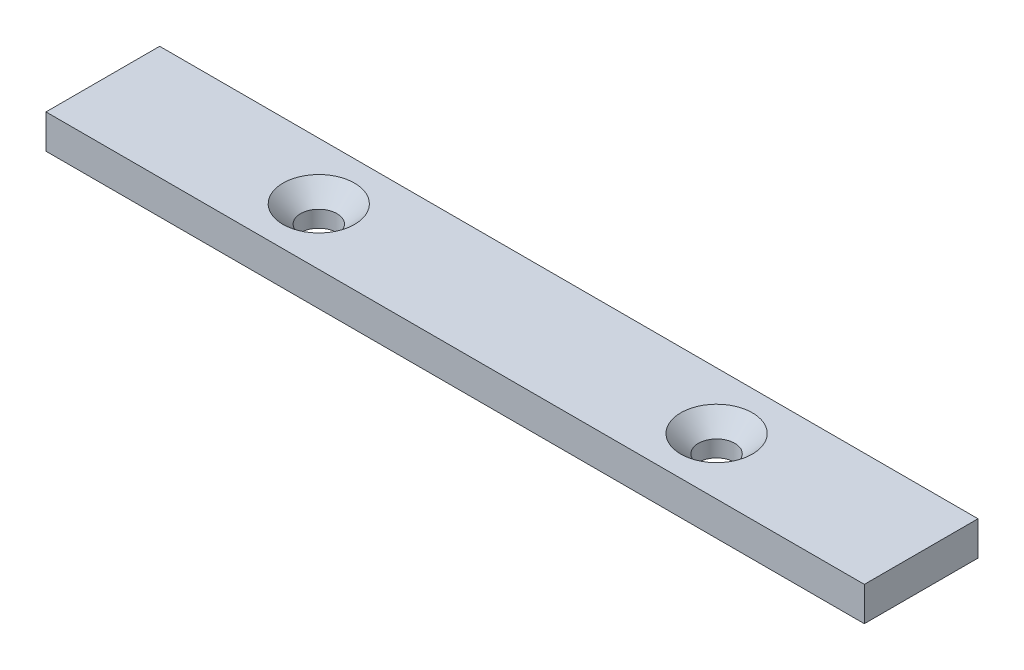
from build123d import *

# Parameters (mm, degrees)
SKETCH1_W                                      = 144
SKETCH1_H                                      = 20
BOSS_EXTRUDE1_DEPTH                            = 6
CSK_FOR_M6_FLAT_HEAD_MACHINE_SCREW1_AT_2_COUNT = 2
CSK_FOR_M6_FLAT_HEAD_MACHINE_SCREW1_AT_2_PITCH = 70


with BuildPart() as part:
    # Sketch1 → Boss-Extrude1 (new body)
    with BuildSketch(Plane(origin=(0, 0, 0), x_dir=(1, 0, 0), z_dir=(0, 1, 0))):
        with Locations((72, -10)):
            Rectangle(SKETCH1_W, SKETCH1_H)
    extrude(amount=BOSS_EXTRUDE1_DEPTH)

    # Sketch3 → CSK for M6 Flat Head Machine Screw1 (revolve, cut)
    with BuildSketch(Plane(origin=(38, 6, 10), x_dir=(0, 0, 1), z_dir=(1, 0, 0))):
        Polygon((0, 0), (0, 6), (3.2, 6), (3.2, 3.1), (6.3, 0), align=None)
    csk_for_m6_flat_head_machine_screw1 = revolve(axis=Axis((38, 12.35, 10), (0, -1, 0)), mode=Mode.SUBTRACT)

    # CSK for M6 Flat Head Machine Screw1 at 2: CSK for M6 Flat Head Machine Screw1 ×2
    with Locations(*[(i * CSK_FOR_M6_FLAT_HEAD_MACHINE_SCREW1_AT_2_PITCH, 0, 0) for i in range(1, CSK_FOR_M6_FLAT_HEAD_MACHINE_SCREW1_AT_2_COUNT)]):
        add(csk_for_m6_flat_head_machine_screw1, mode=Mode.SUBTRACT)


solid = part.part
